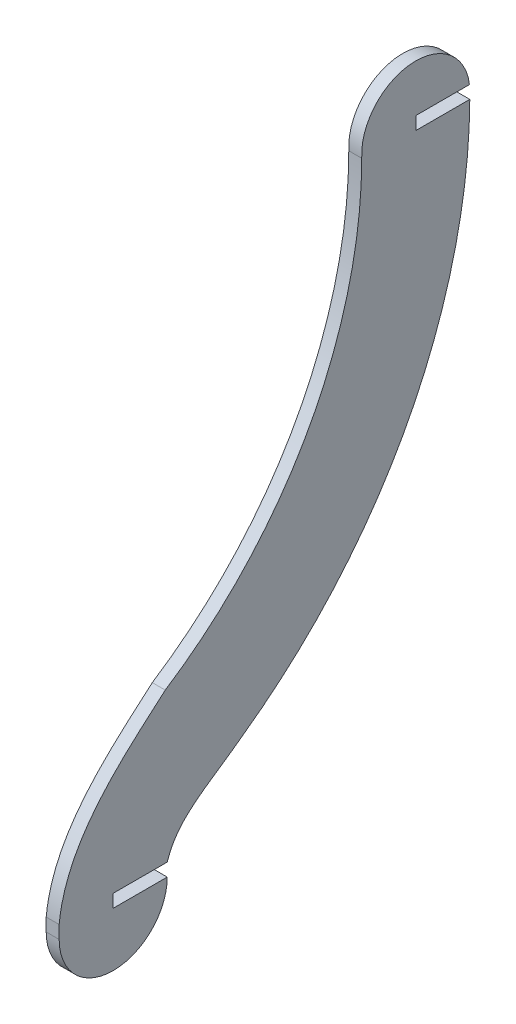
from build123d import *

# Parameters (mm, degrees)
BOSS_EXTRUDE2_DEPTH = 3
SKETCH2_W           = 12.5
SKETCH2_H           = 3
CUT_EXTRUDE1_DEPTH  = 3


with BuildPart() as part:
    # Sketch1 → Boss-Extrude2 (new body)
    with BuildSketch(Plane(origin=(0, 0, 0), x_dir=(0, 0, -1), z_dir=(1, 0, 0))):
        with BuildLine():
            Line((125, 0), (125, 1.5))
            ThreePointArc((125, 1.5), (111.75, 13.25), (100, 0))
            ThreePointArc((100, 0), (87.904372108, -47.674116292), (54.543572715, -83.81526517))
            add(Edge.make_bspline(
                [(54.543572715, -83.81526517), (44.434436781, -92.608940988), (31.581333534, -102.945692353), (30, -118.5)],
                knots=[0, 0, 0, 0, 1, 1, 1, 1], degree=3))
            Line((30, -118.5), (30, -121.5))
            ThreePointArc((30, -121.5), (42.5, -134), (55, -121.5))
            Line((55, -121.5), (55, -118.5))
            add(Edge.make_bspline(
                [(55, -118.5), (57.384287812, -110.868607185), (64.548856078, -107.860641761), (72.347282186, -101.935620665)],
                knots=[0, 0, 0, 0, 1, 1, 1, 1], degree=3))
            ThreePointArc((72.347282186, -101.935620665), (111.059466668, -57.365450084), (125, 0))
        make_face()
    extrude(amount=BOSS_EXTRUDE2_DEPTH)

    # Sketch2 → Cut-Extrude1 (cut)
    with BuildSketch(Plane(origin=(3, 0, 0), x_dir=(0, 0, -1), z_dir=(1, 0, 0))):
        with Locations((118.75, 0.8091646)):
            Rectangle(SKETCH2_W, SKETCH2_H)
        with Locations((48.75, -120)):
            Rectangle(SKETCH2_W, SKETCH2_H)
    extrude(amount=-CUT_EXTRUDE1_DEPTH, mode=Mode.SUBTRACT)


solid = part.part
